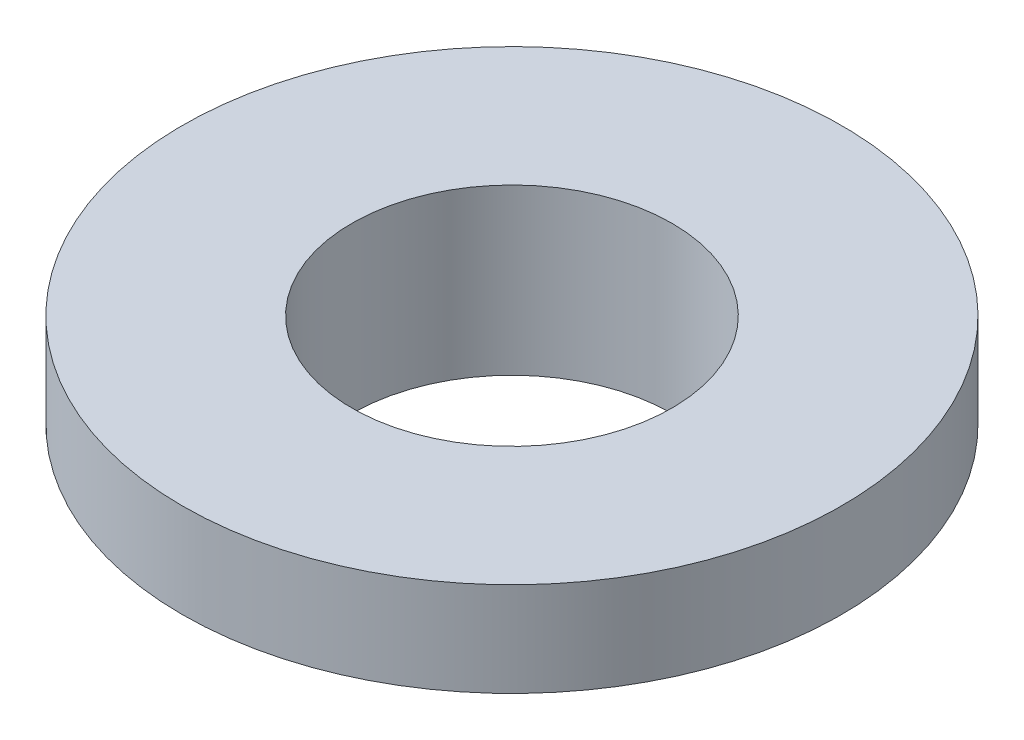
from build123d import *

# Parameters (mm, degrees)
SKETCH1_R           = 5.715
SKETCH1_R_2         = 4.318
BOSS_EXTRUDE1_DEPTH = 1.905
SKETCH2_R           = 8.89
SKETCH2_R_2         = 4.318
BOSS_EXTRUDE2_DEPTH = 2.54


with BuildPart() as part:
    # Sketch1 → Boss-Extrude1 (new body)
    with BuildSketch(Plane(origin=(0, 0, 0), x_dir=(1, 0, 0), z_dir=(0, 1, 0))):
        with Locations(Location((0, 0, 0), (0, 0, 90))):
            Circle(SKETCH1_R)
        with Locations(Location((0, 0, 0), (0, 0, 90))):
            Circle(SKETCH1_R_2, mode=Mode.SUBTRACT)
    extrude(amount=BOSS_EXTRUDE1_DEPTH)

    # Sketch2 → Boss-Extrude2 (add)
    with BuildSketch(Plane(origin=(0, 1.905, 0), x_dir=(1, 0, 0), z_dir=(0, 1, 0))):
        with Locations(Location((0, 0, 0), (0, 0, 270))):
            Circle(SKETCH2_R)
        with Locations(Location((0, 0, 0), (0, 0, 90))):
            Circle(SKETCH2_R_2, mode=Mode.SUBTRACT)
    extrude(amount=BOSS_EXTRUDE2_DEPTH)


solid = part.part
